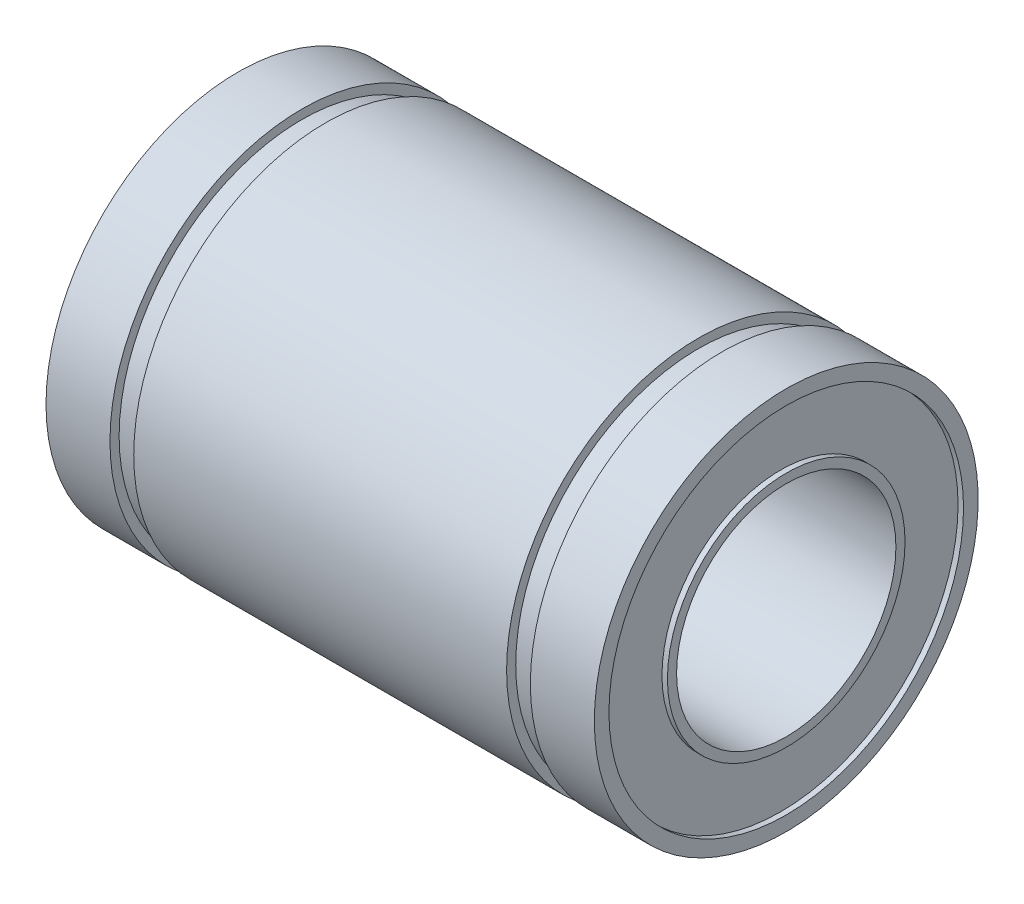
from build123d import *


with BuildPart() as part:
    # Sketch1 → Revolve1 (revolve)
    with BuildSketch(Plane.XY, mode=Mode.PRIVATE) as revolve1_sk:
        Polygon((-15, 6), (15, 6), (15, 6.5), (14.7, 6.5), (14.7, 9.7), (15, 9.7), (15, 10.5), (11.5, 10.5), (11.5, 10), (10.2, 10), (10.2, 10.5), (-10.2, 10.5), (-10.2, 10), (-11.5, 10), (-11.5, 10.5), (-15, 10.5), (-15, 9.7), (-14.7, 9.7), (-14.7, 6.5), (-15, 6.5), align=None)
    revolve(revolve1_sk.sketch.rotate(Axis((-15, 0, 0), (1, 0, 0)), 90), axis=Axis((-15, 0, 0), (1, 0, 0)))


solid = part.part
